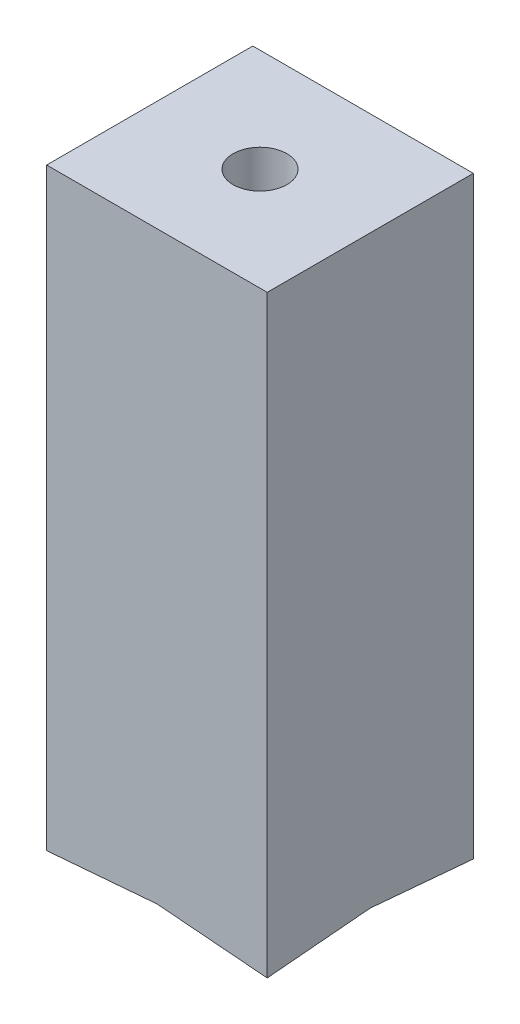
from build123d import *

# Parameters (mm, degrees)
SKETCH1_W             = 20.5
SKETCH1_H             = 19.16
BOSS_EXTRUDE1_DEPTH   = 55.2
CUT_EXTRUDE3_DEPTH    = 60.657911462
CUT_EXTRUDE4_DEPTH    = 60.322913785
M6_TAPPED_HOLE1_D     = 5
M6_TAPPED_HOLE1_DEPTH = 15
M6_TAPPED_HOLE1_TIP   = 1.502151548


with BuildPart() as part:
    # Sketch1 → Boss-Extrude1 (new body)
    with BuildSketch(Plane(origin=(0, 0, 0), x_dir=(1, 0, 0), z_dir=(0, 1, 0))):
        Rectangle(SKETCH1_W, SKETCH1_H)
    extrude(amount=-BOSS_EXTRUDE1_DEPTH)

    # Sketch5 → Cut-Extrude3 (cut, through all)
    with BuildSketch(Plane(origin=(10.25, 0, 0), x_dir=(0, 0, -1), z_dir=(1, 0, 0))):
        Polygon((-9.58, -55.2), (0, -54.361858603), (9.58, -55.2), align=None)
    extrude(amount=-CUT_EXTRUDE3_DEPTH, mode=Mode.SUBTRACT)

    # Sketch6 → Cut-Extrude4 (cut, through all)
    with BuildSketch(Plane(origin=(0, 0, -9.58), x_dir=(-1, 0, 0), z_dir=(0, 0, -1))):
        Polygon((-10.25, -55.2), (0, -54.361858603), (10.25, -55.2), align=None)
    extrude(amount=-CUT_EXTRUDE4_DEPTH, mode=Mode.SUBTRACT)

    # M6 Tapped Hole1
    with Locations(Plane(origin=(0, 0, 0), x_dir=(1, 0, 0), z_dir=(0, 1, 0))):
        with Locations((0, 0)):
            Hole(M6_TAPPED_HOLE1_D / 2, depth=M6_TAPPED_HOLE1_DEPTH)
            with Locations((0, 0, -(M6_TAPPED_HOLE1_DEPTH + M6_TAPPED_HOLE1_TIP / 2))):  # 118° drill point
                Cone(0, M6_TAPPED_HOLE1_D / 2, M6_TAPPED_HOLE1_TIP, mode=Mode.SUBTRACT)


solid = part.part
